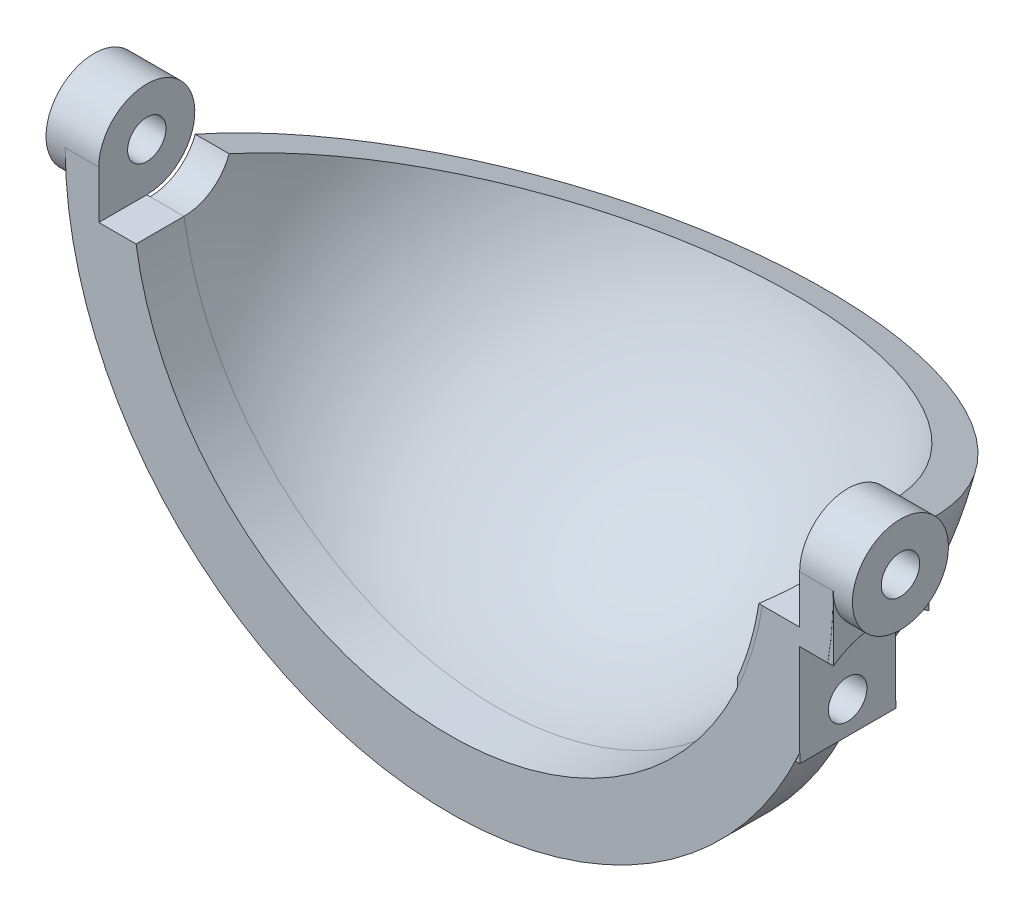
from build123d import *

# Parameters (mm, degrees)
EXTRUDE_1_DEPTH          = 2.5
REVOLVE_1_ANGLE          = 70.00000000000016
EXTRUDE_2_DEPTH          = 20
EXTRUDE_2_DEPTH_BACK     = 20
SKETCH_4_R               = 2.5
SKETCH_4_R_2             = 1
CUT_EXTRUDE_1_DEPTH      = 18.25
CUT_EXTRUDE_1_DEPTH_BACK = 18.25
SKETCH_5_R               = 1
CUT_EXTRUDE_START        = -100
SKETCH_6_R               = 1
CUT_EXTRUDE_2_DEPTH      = 100
EXTRUDE_START            = -5
SKETCH_8_R               = 1
EXTRUDE_3_DEPTH          = 5
SKETCH_9_R               = 1.004563182831931
CUT_EXTRUDE_3_DEPTH      = 10
EXTRUDE_START_2          = 1
SKETCH_10_R              = 2.5
SKETCH_10_R_2            = 1
EXTRUDE_4_DEPTH          = 1
SKETCH_11_R              = 2.500000000000001
SKETCH_11_R_2            = 1.0000000000000002
EXTRUDE_5_DEPTH          = 1
SKETCH_13_W              = 11.686063100659794
SKETCH_13_H              = 0.769389088656252
CUT_EXTRUDE_4_DEPTH      = 10
CUT_EXTRUDE_5_DEPTH      = 10
SKETCH_15_R              = 4.4
CUT_EXTRUDE_7_DEPTH      = 1.75


with BuildPart() as part:
    # 草图1 → 凸台-拉伸1 (new body)
    with BuildSketch(Plane.XY):
        with BuildLine():
            Line((-20, 0), (-16.500000000000004, 0))
            ThreePointArc((-16.500000000000004, 0), (1.01e-15, -16.499999999999996), (16.500000000000004, 0))
            Line((16.500000000000004, 0), (20, 0))
            ThreePointArc((20, 0), (1.22e-15, -19.999999999999982), (-20, 0))
        make_face()
    extrude(amount=EXTRUDE_1_DEPTH)

    # 草图2 → 旋转1 (revolve)
    with BuildSketch(Plane(origin=(0, 0, 0), x_dir=(-1, 0, 0), z_dir=(0, 0, -1))):
        with BuildLine():
            Line((-18.25, 0), (-16.500000000000004, 0))
            ThreePointArc((-16.500000000000004, 0), (1.01e-15, -16.5), (16.500000000000004, 1.33e-15))
            Line((16.500000000000004, 1.33e-15), (18.250000000000004, 6.6e-16))
            ThreePointArc((18.250000000000004, 6.6e-16), (-2.93e-15, -18.25), (-18.25, 0))
        make_face()
    revolve(axis=Axis((16.500000000000004, 0, 0), (1, -4e-17, 0)), revolution_arc=REVOLVE_1_ANGLE)

    # 草图4 → 凸台-拉伸2 (add, two sides: drawn at the far end of the back side and taken through both)
    with BuildSketch(Plane(origin=(0, 0, 0), x_dir=(0, 0, -1), z_dir=(1, 0, 0)).offset(-EXTRUDE_2_DEPTH_BACK)):
        Circle(SKETCH_4_R)
        Circle(SKETCH_4_R_2, mode=Mode.SUBTRACT)
    extrude(amount=EXTRUDE_2_DEPTH + EXTRUDE_2_DEPTH_BACK)

    # 草图5 → 切除-拉伸1 (cut, two sides: drawn at the far end of the back side and taken through both)
    with BuildSketch(Plane(origin=(0, 0, 0), x_dir=(0, 0, -1), z_dir=(1, 0, 0)).offset(-CUT_EXTRUDE_1_DEPTH_BACK)):
        with BuildLine():
            Line((0, -2.5), (-2.5, -2.5))
            Line((-2.5, -2.5), (-2.5, 0))
            ThreePointArc((-2.5, 0), (1.767766952966369, 1.76776695296637), (0, -2.5))
        make_face()
        Circle(SKETCH_5_R, mode=Mode.SUBTRACT)
    extrude(amount=CUT_EXTRUDE_1_DEPTH + CUT_EXTRUDE_1_DEPTH_BACK, mode=Mode.SUBTRACT)

    # 草图6 → 切除-拉伸2 (cut)
    with BuildSketch(Plane(origin=(20, 0, 0), x_dir=(0, 0, -1), z_dir=(1, 0, 0)).offset(CUT_EXTRUDE_START)):
        Circle(SKETCH_6_R)
    extrude(amount=CUT_EXTRUDE_2_DEPTH, mode=Mode.SUBTRACT)

    # 草图8 → 凸台-拉伸3 (add)
    with BuildSketch(Plane(origin=(20, 0, 0), x_dir=(0, 0, -1), z_dir=(1, 0, 0)).offset(EXTRUDE_START)):
        with BuildLine():
            ThreePointArc((2.494892647035231, -0.15972063038174344), (0.00312163823150463, -2.499998051074191), (-2.4944859955512104, -0.1659506492873415))
            Line((-2.49448599555121, -0.1659506492873411), (-2.494485995551209, -8.66595064928734))
            Line((-2.494485995551209, -8.66595064928734), (2.505514004448791, -8.66595064928734))
            Line((2.505514004448791, -8.66595064928734), (2.4948926470352397, -0.15972063038174333))
        make_face()
        with Locations((8.6e-16, -7)):
            Circle(SKETCH_8_R, mode=Mode.SUBTRACT)
    extrude(amount=EXTRUDE_3_DEPTH)

    # 草图9 → 切除-拉伸3 (cut)
    with BuildSketch(Plane(origin=(20, 0, 0), x_dir=(0, 0, -1), z_dir=(1, 0, 0))):
        with Locations((8.6e-16, -7)):
            Circle(SKETCH_9_R)
    extrude(amount=-CUT_EXTRUDE_3_DEPTH, mode=Mode.SUBTRACT)

    # 草图10 → 凸台-拉伸4 (add)
    with BuildSketch(Plane.ZY.offset(20).offset(EXTRUDE_START_2)):
        Circle(SKETCH_10_R)
        Circle(SKETCH_10_R_2, mode=Mode.SUBTRACT)
    extrude(amount=-EXTRUDE_4_DEPTH)

    # 草图11 → 凸台-拉伸5 (add)
    with BuildSketch(Plane(origin=(20, 0, 0), x_dir=(0, 0, -1), z_dir=(1, 0, 0))):
        Circle(SKETCH_11_R)
        Circle(SKETCH_11_R_2, mode=Mode.SUBTRACT)
    extrude(amount=EXTRUDE_5_DEPTH)

    # 草图12 → 切除-旋转1 (revolve, cut)
    with BuildSketch(Plane.XY):
        with BuildLine():
            Line((-16.499999999999996, 0), (16.499999999999996, 0))
            ThreePointArc((16.499999999999996, 0), (1.01e-15, -16.499999999999993), (-16.499999999999996, 0))
        make_face()
    revolve(axis=Axis((-16.499999999999996, 0, 0), (1, 0, 0)), mode=Mode.SUBTRACT)

    # 草图13 → 切除-拉伸4 (cut)
    with BuildSketch(Plane(origin=(0, 0.00311500945287562, -2.4946893212932255), x_dir=(-1, 0, 0), z_dir=(0, 0.00124865529263255, -0.9999992204296763))):
        with Locations((-12.406968449670103, -0.5475303111045247)):
            Rectangle(SKETCH_13_W, SKETCH_13_H)
    extrude(amount=-CUT_EXTRUDE_4_DEPTH, mode=Mode.SUBTRACT)

    # 草图14 → 切除-拉伸5 (cut)
    with BuildSketch(Plane.ZY.offset(-18.25)):
        Polygon((-0.00312163823158233, 1.94892580969e-06), (2.4999999999999996, 1.94892580969e-06), (2.5, -2.5), (-0.00312163823158202, -2.4999980510741904), align=None)
    extrude(amount=CUT_EXTRUDE_5_DEPTH, mode=Mode.SUBTRACT)

    # 草图15 → 切除-拉伸7 (cut)
    with BuildSketch(Plane(origin=(20, 0, 0), x_dir=(0, 0, -1), z_dir=(1, 0, 0))):
        with Locations((8.6e-16, -7)):
            Circle(SKETCH_15_R)
    extrude(amount=-CUT_EXTRUDE_7_DEPTH, mode=Mode.SUBTRACT)


solid = part.part
